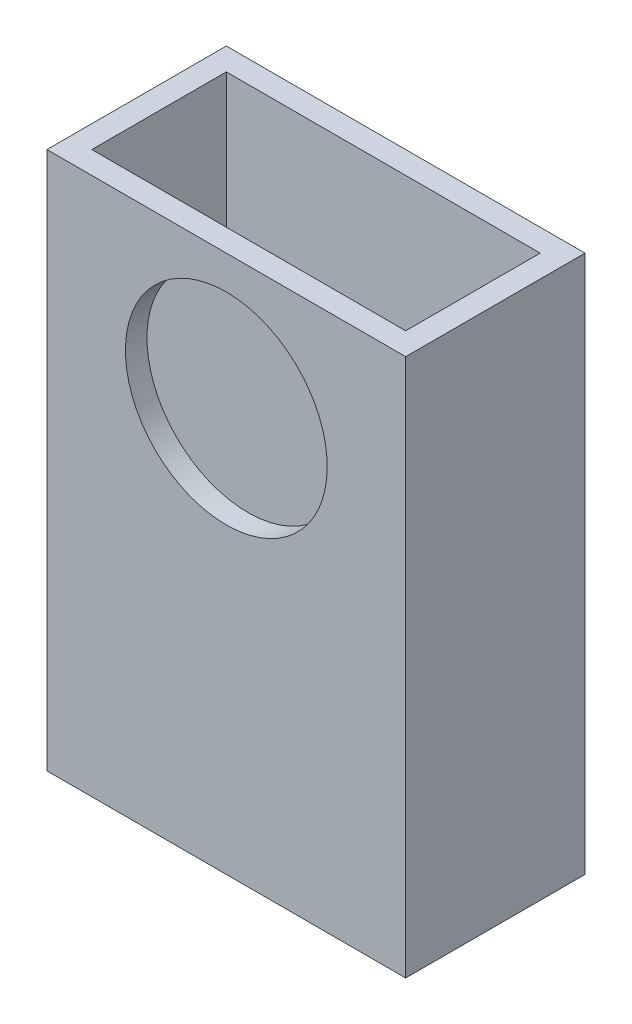
from build123d import *

# Parameters (mm, degrees)
SKETCH1_W           = 50.8
SKETCH1_H           = 76.2
BOSS_EXTRUDE1_DEPTH = 25.4
SKETCH2_W           = 44.45
SKETCH2_H           = 19.05
CUT_EXTRUDE1_DEPTH  = 96.038097624
SKETCH3_R           = 14.2875
CUT_EXTRUDE2_DEPTH  = 3.048


with BuildPart() as part:
    # Sketch1 → Boss-Extrude1 (new body)
    with BuildSketch(Plane.XY):
        with Locations((25.4, 38.1)):
            Rectangle(SKETCH1_W, SKETCH1_H)
    extrude(amount=BOSS_EXTRUDE1_DEPTH)

    # Sketch2 → Cut-Extrude1 (cut, through all)
    with BuildSketch(Plane.XZ):
        with Locations((25.4, 12.7)):
            Rectangle(SKETCH2_W, SKETCH2_H)
    extrude(amount=-CUT_EXTRUDE1_DEPTH, mode=Mode.SUBTRACT)

    # Sketch3 → Cut-Extrude2 (cut)
    with BuildSketch(Plane.XY.offset(25.4)):
        with Locations((25.4, 57.15)):
            Circle(SKETCH3_R)
    extrude(amount=-CUT_EXTRUDE2_DEPTH, mode=Mode.SUBTRACT)


solid = part.part
